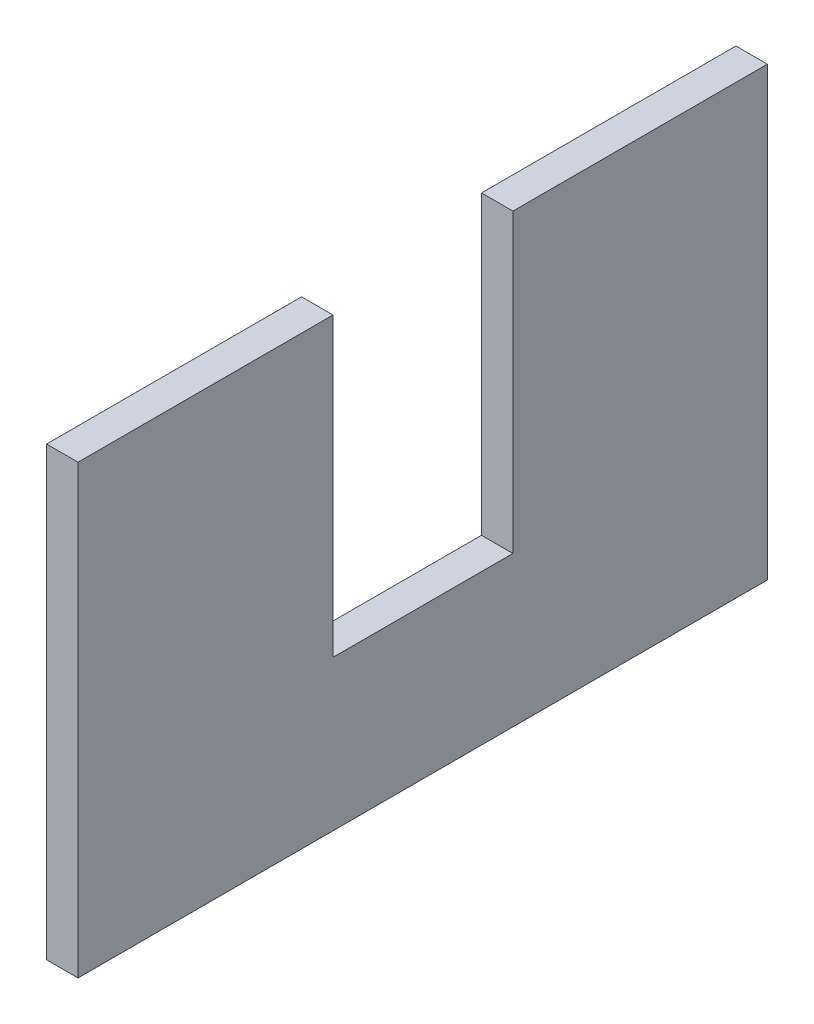
from build123d import *

# Parameters (mm, degrees)
SALIENTE_EXTRUIR1_DEPTH = 5


with BuildPart() as part:
    # Croquis1 → Saliente-Extruir1 (new body)
    with BuildSketch(Plane(origin=(0, 0, 0), x_dir=(0, 0, -1), z_dir=(1, 0, 0))):
        Polygon((28.59175032, 45.396017699), (69.041946927, 45.396017699), (69.041946927, -25.603982301), (-40.526548673, -25.603982301), (-40.526548673, 45.396017699), (0, 45.396017699), (0, -1.726418895), (28.59175032, -1.726418895), align=None)
    extrude(amount=SALIENTE_EXTRUIR1_DEPTH)


solid = part.part
